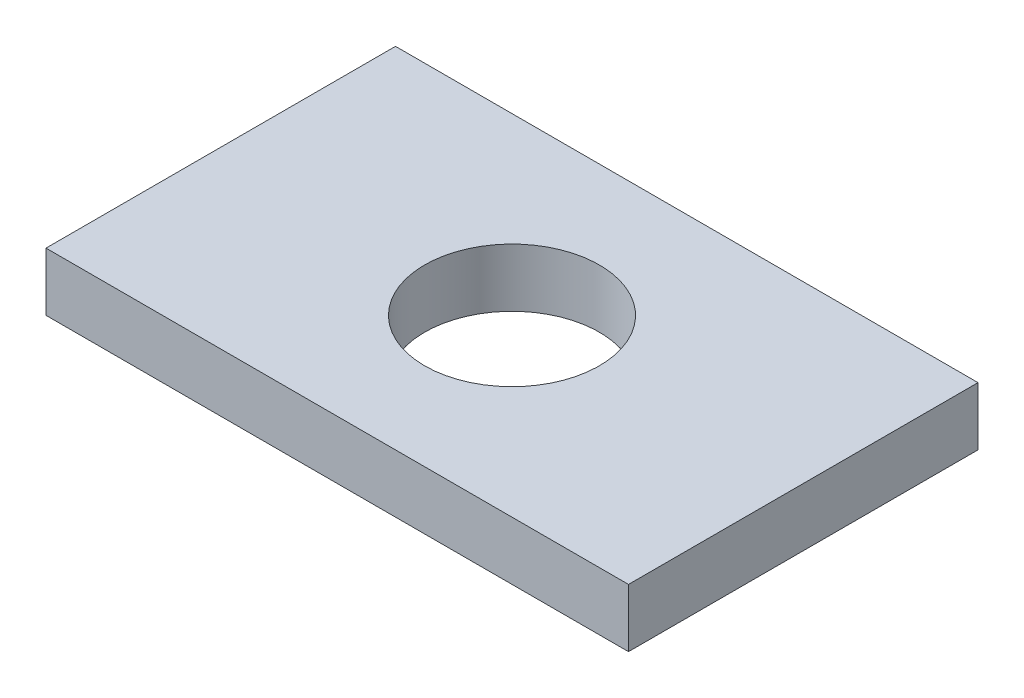
from build123d import *

# Parameters (mm, degrees)
SKETCH1_W           = 20
SKETCH1_H           = 12
SKETCH1_R           = 3
BOSS_EXTRUDE1_DEPTH = 2


with BuildPart() as part:
    # Sketch1 → Boss-Extrude1 (new body)
    with BuildSketch(Plane(origin=(0, 0, 0), x_dir=(1, 0, 0), z_dir=(0, 1, 0))):
        with Locations((10, 6)):
            Rectangle(SKETCH1_W, SKETCH1_H)
        with Locations(Location((10, 6, 0), (0, 0, 270))):
            Circle(SKETCH1_R, mode=Mode.SUBTRACT)
    extrude(amount=BOSS_EXTRUDE1_DEPTH)


solid = part.part
